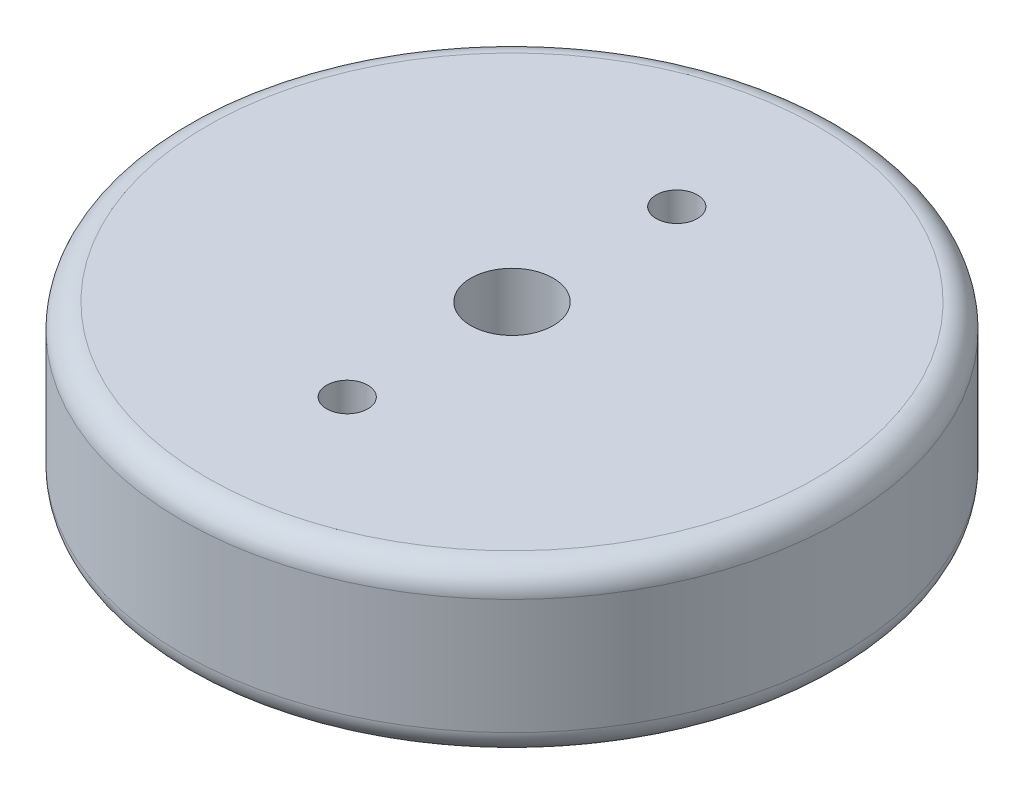
from build123d import *

# Parameters (mm, degrees)
SKETCH_1_R          = 40
SKETCH_1_R_2        = 5
EXTRUDE_1_DEPTH     = 20
FILLET_1_R          = 3
SKETCH_2_R          = 2.5
CUT_EXTRUDE_1_DEPTH = 61


with BuildPart() as part:
    # 草圖1 → 填料-伸長1 (new body)
    with BuildSketch(Plane(origin=(0, 0, 0), x_dir=(1, 0, 0), z_dir=(0, 1, 0))):
        with Locations(Location((0, 0, 0), (0, 0, 270))):
            Circle(SKETCH_1_R)
        with Locations(Location((0, 0, 0), (0, 0, 270))):
            Circle(SKETCH_1_R_2, mode=Mode.SUBTRACT)
    extrude(amount=EXTRUDE_1_DEPTH)

    # 圓角1
    fillet_1_edges = [part.edges().sort_by_distance(p)[0] for p in [
        (0, 0, -40),
        (0, 20, -40),
    ]]
    fillet(fillet_1_edges, radius=FILLET_1_R)

    # 草圖2 → 除料-伸長1 (cut, through all)
    with BuildSketch(Plane(origin=(0, 20, 0), x_dir=(1, 0, 0), z_dir=(0, 1, 0))):
        with Locations(Location((0, 20, 0), (0, 0, 270))):
            Circle(SKETCH_2_R)
        with Locations(Location((0, -20, 0), (0, 0, 270))):
            Circle(SKETCH_2_R)
    extrude(amount=-CUT_EXTRUDE_1_DEPTH, mode=Mode.SUBTRACT)


solid = part.part
